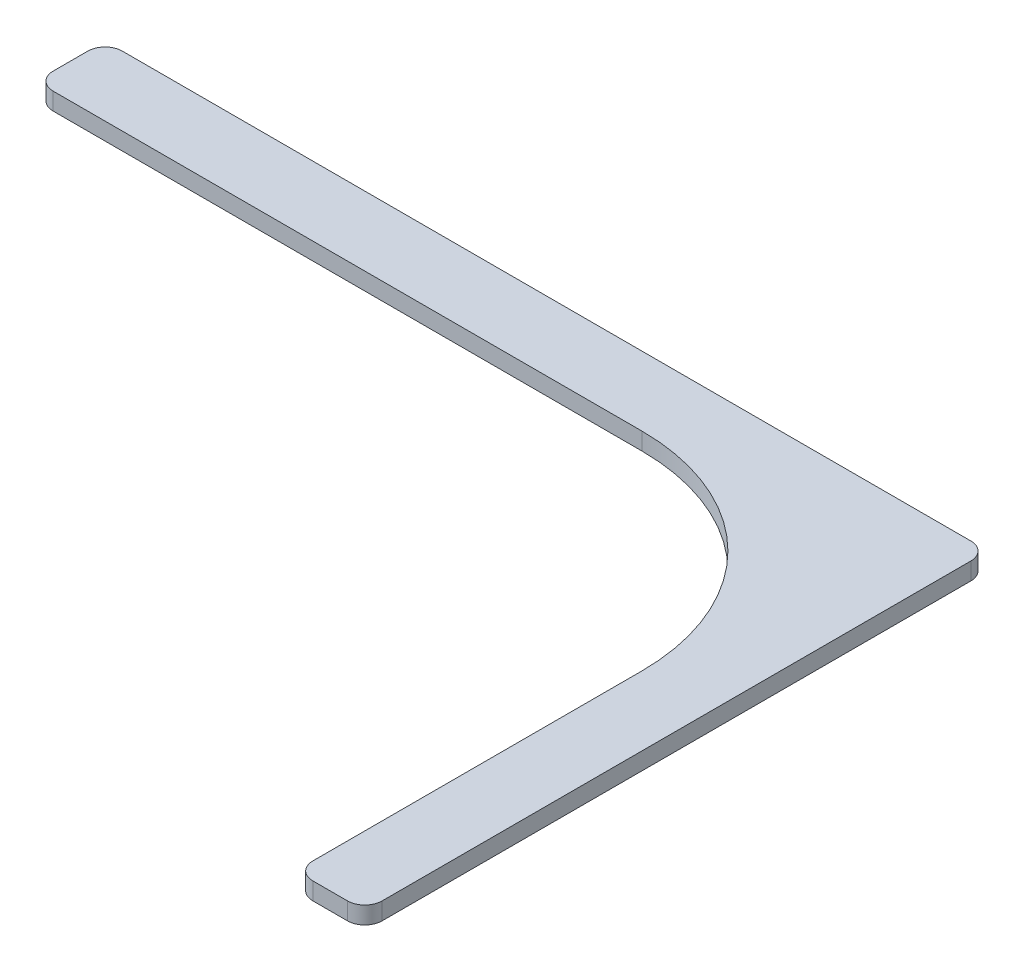
from build123d import *

# Parameters (mm, degrees)
BOSS_EXTRUDE1_DEPTH = 6.35
FILLET1_R           = 6.35
FILLET2_R           = 76.2


with BuildPart() as part:
    # Sketch1 → Boss-Extrude1 (new body)
    with BuildSketch(Plane(origin=(0, 0, 0), x_dir=(1, 0, 0), z_dir=(0, 1, 0))):
        Polygon((0, 0), (0, 228.6), (-323.85, 228.6), (-323.85, 203.2), (-25.4, 203.2), (-25.4, 0), align=None)
    extrude(amount=BOSS_EXTRUDE1_DEPTH)

    # Fillet1
    fillet1_edges = [part.edges().sort_by_distance(p)[0] for p in [
        (-25.4, 3.175, 0),
        (-323.85, 3.175, -203.2),
        (-323.85, 3.175, -228.6),
        (0, 3.175, -228.6),
        (0, 3.175, 0),
    ]]
    fillet(fillet1_edges, radius=FILLET1_R)

    # Fillet2
    fillet2_edges = [part.edges().sort_by_distance(p)[0] for p in [
        (-25.4, 3.175, -203.2),
    ]]
    fillet(fillet2_edges, radius=FILLET2_R)


solid = part.part
